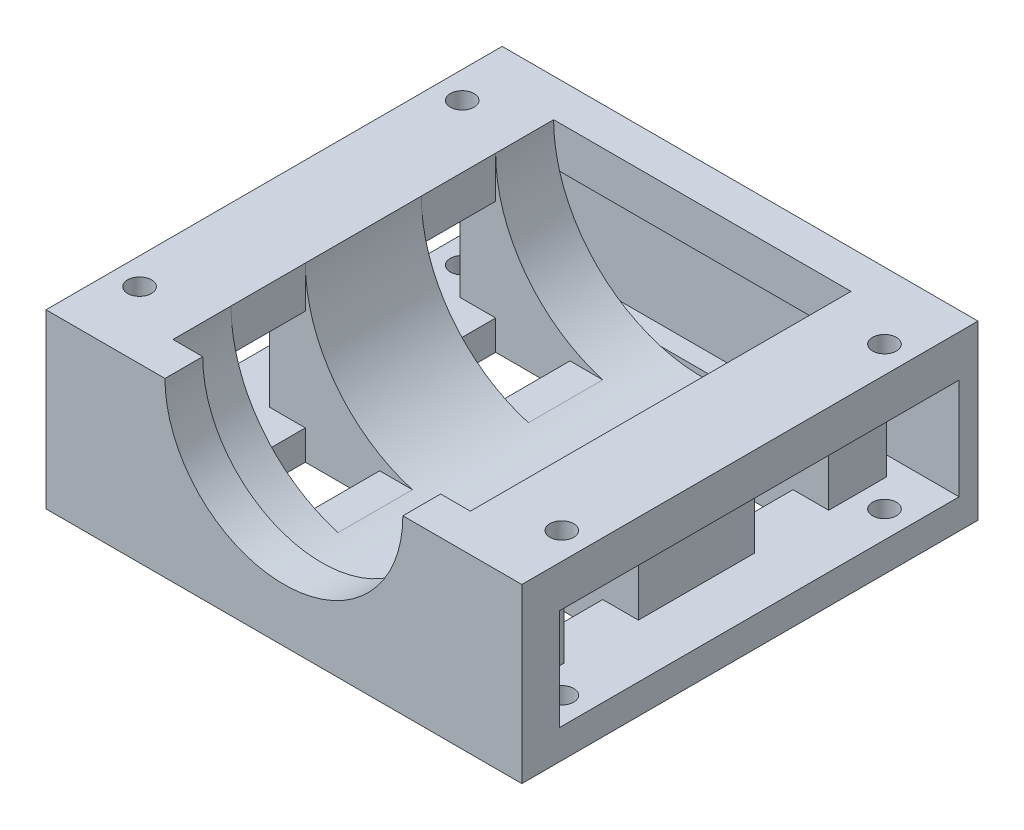
from build123d import *

# Parameters (mm, degrees)
BOSS_EXTRUDE1_DEPTH            = 64
BOSS_EXTRUDE2_DEPTH            = 6.35
SKETCH3_W                      = 12.5
SKETCH3_H                      = 12.5
CUT_EXTRUDE1_DEPTH             = 29
CUT_EXTRUDE2_REACH             = 102.076
SKETCH5_W                      = 12.5
SKETCH5_H                      = 17
CUT_EXTRUDE2_DIRECTION_2_REACH = 102.076
CUT_EXTRUDE3_REACH             = 112.409
SKETCH6_R                      = 2
SKETCH7_W                      = 80
SKETCH7_H                      = 29
BOSS_EXTRUDE3_DEPTH            = 6.35
SKETCH8_W                      = 3.175
SKETCH8_H                      = 17
CUT_EXTRUDE4_DEPTH             = 80


with BuildPart() as part:
    # Sketch1 → Boss-Extrude1 (new body)
    with BuildSketch(Plane.XY):
        with BuildLine():
            Line((0, 0), (80, 0))
            Line((80, 0), (80, 5))
            Line((80, 5), (71, 5))
            Line((71, 5), (71, 22))
            Line((71, 22), (80, 22))
            Line((80, 22), (80, 29))
            Line((80, 29), (65, 29))
            ThreePointArc((65, 29), (40, 4), (15, 29))
            Line((15, 29), (0, 29))
            Line((0, 29), (0, 22))
            Line((0, 22), (9, 22))
            Line((9, 22), (9, 5))
            Line((9, 5), (0, 5))
            Line((0, 5), (0, 0))
        make_face()
    extrude(amount=BOSS_EXTRUDE1_DEPTH)

    # Sketch2 → Boss-Extrude2 (add)
    with BuildSketch(Plane.XY.offset(64)):
        with BuildLine():
            Line((60, 29), (80, 29))
            Line((80, 29), (80, 0))
            Line((80, 0), (0, 0))
            Line((0, 0), (0, 29))
            Line((0, 29), (20, 29))
            ThreePointArc((20, 29), (40, 9), (60, 29))
        make_face()
    extrude(amount=BOSS_EXTRUDE2_DEPTH)

    # Sketch3 → Cut-Extrude1 (cut)
    with BuildSketch(Plane(origin=(0, 29, 0), x_dir=(1, 0, 0), z_dir=(0, 1, 0))):
        with Locations((21.25, -16)):
            Rectangle(SKETCH3_W, SKETCH3_H)
        with Locations((58.75, -16)):
            Rectangle(SKETCH3_W, SKETCH3_H)
        with Locations((21.25, -48)):
            Rectangle(SKETCH3_W, SKETCH3_H)
        with Locations((58.75, -48)):
            Rectangle(SKETCH3_W, SKETCH3_H)
    extrude(amount=-CUT_EXTRUDE1_DEPTH, mode=Mode.SUBTRACT)

    # Cut-Extrude2: up to this face of the body (flat: up to its plane)
    cut_extrude2_end = Plane(part.part.faces().sort_by_distance((9, 13.5, 32))[0])
    # Sketch5 → Cut-Extrude2 (cut, up to the picked face)
    with BuildSketch(Plane(origin=(15, 0, 0), x_dir=(0, 0, -1), z_dir=(1, 0, 0)), mode=Mode.PRIVATE) as cut_extrude2_sk1:
        with Locations((-48, 13.5)):
            Rectangle(SKETCH5_W, SKETCH5_H)
    cut_extrude2_tool1 = split(extrude(cut_extrude2_sk1.sketch, amount=-CUT_EXTRUDE2_REACH, mode=Mode.PRIVATE), bisect_by=cut_extrude2_end, keep=Keep.BOTH, mode=Mode.PRIVATE)
    # Sketch5 → Cut-Extrude2 (cut, up to the picked face)
    with BuildSketch(Plane(origin=(15, 0, 0), x_dir=(0, 0, -1), z_dir=(1, 0, 0)), mode=Mode.PRIVATE) as cut_extrude2_sk2:
        with Locations((-16, 13.5)):
            Rectangle(SKETCH5_W, SKETCH5_H)
    cut_extrude2_tool2 = split(extrude(cut_extrude2_sk2.sketch, amount=-CUT_EXTRUDE2_REACH, mode=Mode.PRIVATE), bisect_by=cut_extrude2_end, keep=Keep.BOTH, mode=Mode.PRIVATE)
    add(cut_extrude2_tool1.solids().sort_by(Axis((15, 13.5, 48), (-1, 0, 0)))[0], mode=Mode.SUBTRACT)
    add(cut_extrude2_tool2.solids().sort_by(Axis((15, 13.5, 16), (-1, 0, 0)))[0], mode=Mode.SUBTRACT)

    # Cut-Extrude2 direction 2: up to this face of the body (flat: up to its plane)
    cut_extrude2_direction_2_end = Plane(part.part.faces().sort_by_distance((71, 13.5, 32))[0])
    # Sketch5 → Cut-Extrude2 direction 2 (cut, up to the picked face)
    with BuildSketch(Plane(origin=(15, 0, 0), x_dir=(0, 0, -1), z_dir=(1, 0, 0)), mode=Mode.PRIVATE) as cut_extrude2_direction_2_sk1:
        with Locations((-48, 13.5)):
            Rectangle(SKETCH5_W, SKETCH5_H)
    cut_extrude2_direction_2_tool1 = split(extrude(cut_extrude2_direction_2_sk1.sketch, amount=CUT_EXTRUDE2_DIRECTION_2_REACH, mode=Mode.PRIVATE), bisect_by=cut_extrude2_direction_2_end, keep=Keep.BOTH, mode=Mode.PRIVATE)
    # Sketch5 → Cut-Extrude2 direction 2 (cut, up to the picked face)
    with BuildSketch(Plane(origin=(15, 0, 0), x_dir=(0, 0, -1), z_dir=(1, 0, 0)), mode=Mode.PRIVATE) as cut_extrude2_direction_2_sk2:
        with Locations((-16, 13.5)):
            Rectangle(SKETCH5_W, SKETCH5_H)
    cut_extrude2_direction_2_tool2 = split(extrude(cut_extrude2_direction_2_sk2.sketch, amount=CUT_EXTRUDE2_DIRECTION_2_REACH, mode=Mode.PRIVATE), bisect_by=cut_extrude2_direction_2_end, keep=Keep.BOTH, mode=Mode.PRIVATE)
    add(cut_extrude2_direction_2_tool1.solids().sort_by(Axis((15, 13.5, 48), (1, 0, 0)))[0], mode=Mode.SUBTRACT)
    add(cut_extrude2_direction_2_tool2.solids().sort_by(Axis((15, 13.5, 16), (1, 0, 0)))[0], mode=Mode.SUBTRACT)

    # Cut-Extrude3: up to this face of the body (flat: up to its plane)
    cut_extrude3_end = Plane(part.part.faces().sort_by_distance((72.207911684, 29, 36.109682613))[0])
    # Sketch6 → Cut-Extrude3 (cut, up to the picked face)
    with BuildSketch(Plane(origin=(0, 0, 0), x_dir=(-1, 0, 0), z_dir=(0, -1, 0)), mode=Mode.PRIVATE) as cut_extrude3_sk1:
        with Locations(Location((-4.499910861, -59.125, 0), (0, 0, 90))):
            Circle(SKETCH6_R)
    cut_extrude3_tool1 = split(extrude(cut_extrude3_sk1.sketch, amount=-CUT_EXTRUDE3_REACH, mode=Mode.PRIVATE), bisect_by=cut_extrude3_end, keep=Keep.BOTH, mode=Mode.PRIVATE)
    # Sketch6 → Cut-Extrude3 (cut, up to the picked face)
    with BuildSketch(Plane(origin=(0, 0, 0), x_dir=(-1, 0, 0), z_dir=(0, -1, 0)), mode=Mode.PRIVATE) as cut_extrude3_sk2:
        with Locations(Location((-4.499910861, -4.875, 0), (0, 0, 180))):
            Circle(SKETCH6_R)
    cut_extrude3_tool2 = split(extrude(cut_extrude3_sk2.sketch, amount=-CUT_EXTRUDE3_REACH, mode=Mode.PRIVATE), bisect_by=cut_extrude3_end, keep=Keep.BOTH, mode=Mode.PRIVATE)
    # Sketch6 → Cut-Extrude3 (cut, up to the picked face)
    with BuildSketch(Plane(origin=(0, 0, 0), x_dir=(-1, 0, 0), z_dir=(0, -1, 0)), mode=Mode.PRIVATE) as cut_extrude3_sk3:
        with Locations(Location((-75.500089139, -4.875, 0), (0, 0, 180))):
            Circle(SKETCH6_R)
    cut_extrude3_tool3 = split(extrude(cut_extrude3_sk3.sketch, amount=-CUT_EXTRUDE3_REACH, mode=Mode.PRIVATE), bisect_by=cut_extrude3_end, keep=Keep.BOTH, mode=Mode.PRIVATE)
    # Sketch6 → Cut-Extrude3 (cut, up to the picked face)
    with BuildSketch(Plane(origin=(0, 0, 0), x_dir=(-1, 0, 0), z_dir=(0, -1, 0)), mode=Mode.PRIVATE) as cut_extrude3_sk4:
        with Locations(Location((-75.500089139, -59.125, 0), (0, 0, 180))):
            Circle(SKETCH6_R)
    cut_extrude3_tool4 = split(extrude(cut_extrude3_sk4.sketch, amount=-CUT_EXTRUDE3_REACH, mode=Mode.PRIVATE), bisect_by=cut_extrude3_end, keep=Keep.BOTH, mode=Mode.PRIVATE)
    add(cut_extrude3_tool1.solids().sort_by(Axis((4.499911, 0, 59.125), (0, 1, 0)))[0], mode=Mode.SUBTRACT)
    add(cut_extrude3_tool2.solids().sort_by(Axis((4.499911, 0, 4.875), (0, 1, 0)))[0], mode=Mode.SUBTRACT)
    add(cut_extrude3_tool3.solids().sort_by(Axis((75.500089, 0, 4.875), (0, 1, 0)))[0], mode=Mode.SUBTRACT)
    add(cut_extrude3_tool4.solids().sort_by(Axis((75.500089, 0, 59.125), (0, 1, 0)))[0], mode=Mode.SUBTRACT)

    # Sketch7 → Boss-Extrude3 (add)
    with BuildSketch(Plane(origin=(0, 0, 0), x_dir=(-1, 0, 0), z_dir=(0, 0, -1))):
        with Locations((-40, 14.5)):
            Rectangle(SKETCH7_W, SKETCH7_H)
    extrude(amount=BOSS_EXTRUDE3_DEPTH)

    # Sketch8 → Cut-Extrude4 (cut)
    with BuildSketch(Plane(origin=(80, 0, 0), x_dir=(0, 0, -1), z_dir=(1, 0, 0))):
        with Locations((1.5875, 13.5)):
            Rectangle(SKETCH8_W, SKETCH8_H)
    extrude(amount=-CUT_EXTRUDE4_DEPTH, mode=Mode.SUBTRACT)


solid = part.part
